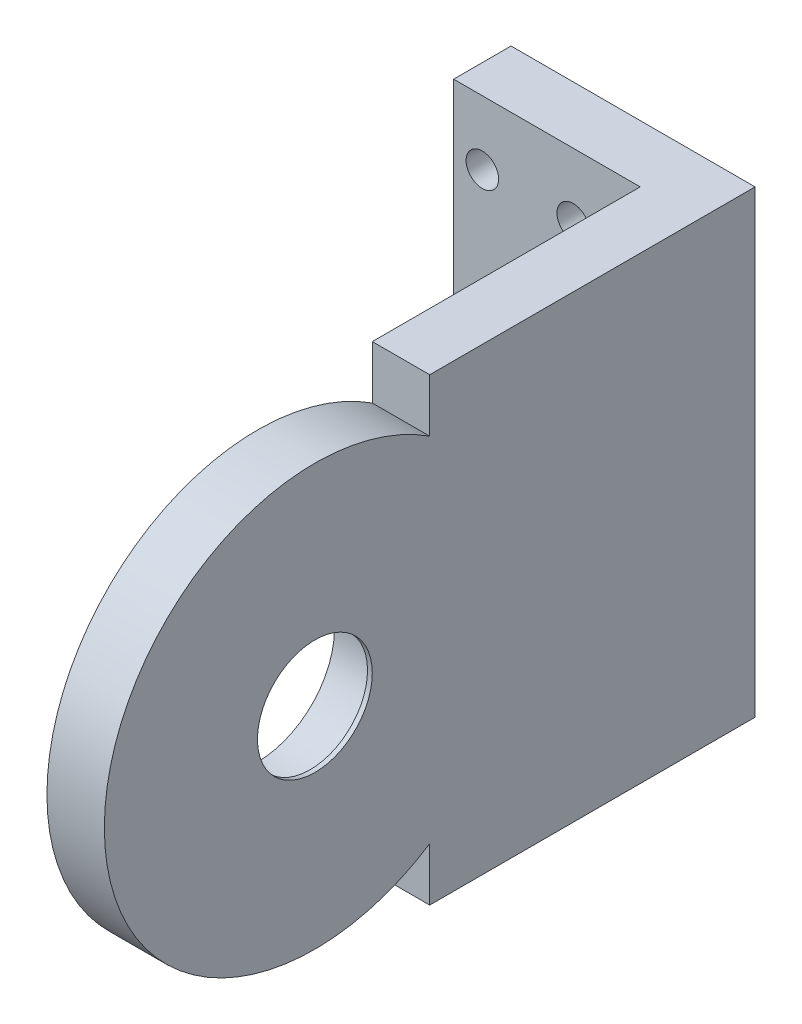
from build123d import *

# Parameters (mm, degrees)
SKETCH1_R           = 22
BOSS_EXTRUDE1_DEPTH = 6
SKETCH2_W           = 34
SKETCH2_H           = 48
BOSS_EXTRUDE2_DEPTH = 6
SKETCH3_R           = 6
CUT_EXTRUDE1_DEPTH  = 6.01
SKETCH4_R           = 8.05
CUT_EXTRUDE2_DEPTH  = 5.5
SKETCH5_W           = 19.51
SKETCH5_H           = 48
SKETCH5_R           = 1.7
BOSS_EXTRUDE3_DEPTH = 6


with BuildPart() as part:
    # Sketch1 → Boss-Extrude1 (new body)
    with BuildSketch(Plane(origin=(336.5, 0, 0), x_dir=(0, 0, -1), z_dir=(1, 0, 0))):
        with Locations((-300, 300)):
            Circle(SKETCH1_R)
    extrude(amount=BOSS_EXTRUDE1_DEPTH)

    # Sketch2 → Boss-Extrude2 (add)
    with BuildSketch(Plane(origin=(336.5, 0, 0), x_dir=(0, 0, -1), z_dir=(1, 0, 0))):
        with Locations((-271, 300)):
            Rectangle(SKETCH2_W, SKETCH2_H)
    extrude(amount=BOSS_EXTRUDE2_DEPTH)

    # Sketch3 → Cut-Extrude1 (cut)
    with BuildSketch(Plane(origin=(336.5, 0, 0), x_dir=(0, 0, -1), z_dir=(1, 0, 0))):
        with Locations((-300, 300)):
            Circle(SKETCH3_R)
    extrude(amount=CUT_EXTRUDE1_DEPTH, mode=Mode.SUBTRACT)

    # Sketch4 → Cut-Extrude2 (cut)
    with BuildSketch(Plane(origin=(336.5, 0, 0), x_dir=(0, 0, -1), z_dir=(1, 0, 0))):
        with Locations((-300, 300)):
            Circle(SKETCH4_R)
    extrude(amount=CUT_EXTRUDE2_DEPTH, mode=Mode.SUBTRACT)

    # Sketch5 → Boss-Extrude3 (add)
    with BuildSketch(Plane.XY.offset(254)):
        with Locations((326.755, 300)):
            Rectangle(SKETCH5_W, SKETCH5_H)
        with Locations((320, 282.7)):
            Circle(SKETCH5_R, mode=Mode.SUBTRACT)
        with Locations((320, 317.3)):
            Circle(SKETCH5_R, mode=Mode.SUBTRACT)
        with Locations((329.5, 282.7)):
            Circle(SKETCH5_R, mode=Mode.SUBTRACT)
        with Locations((329.5, 317.3)):
            Circle(SKETCH5_R, mode=Mode.SUBTRACT)
    extrude(amount=BOSS_EXTRUDE3_DEPTH)


solid = part.part
